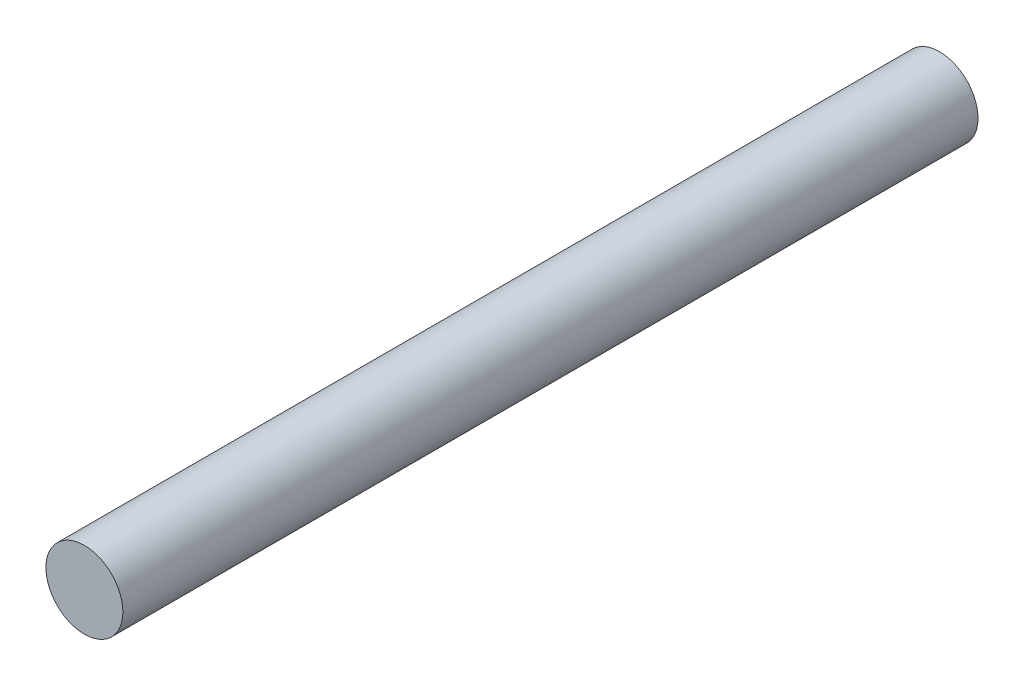
from build123d import *

# Parameters (mm, degrees)
SKETCH1_R           = 90
BOSS_EXTRUDE1_DEPTH = 2000


with BuildPart() as part:
    # Sketch1 → Boss-Extrude1 (new body)
    with BuildSketch(Plane.XY):
        Circle(SKETCH1_R)
    extrude(amount=BOSS_EXTRUDE1_DEPTH)


solid = part.part
